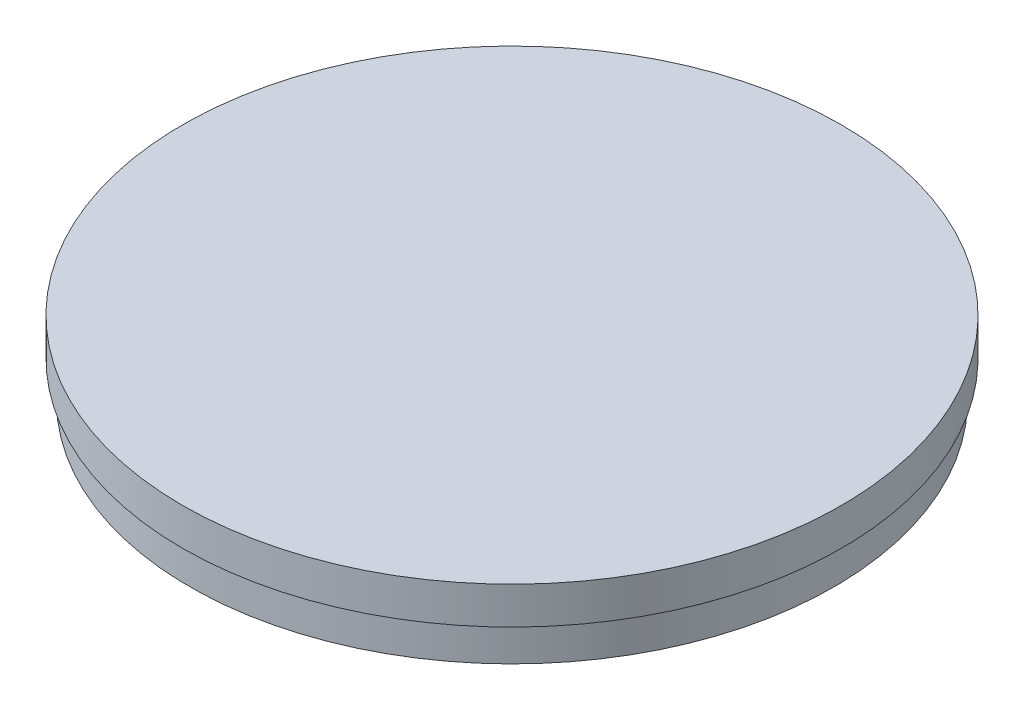
from build123d import *


with BuildPart() as part:
    # Sketch1 → Revolve1 (revolve)
    with BuildSketch(Plane.XY, mode=Mode.PRIVATE) as revolve1_sk:
        Polygon((0, 0), (0, 11.938), (52.959, 11.938), (52.959, 5.969), (51.7652, 5.969), (51.7652, 0), align=None)
    revolve(revolve1_sk.sketch.rotate(Axis((0, 0, 0), (0, 1, 0)), 90), axis=Axis((0, 0, 0), (0, 1, 0)))


solid = part.part
